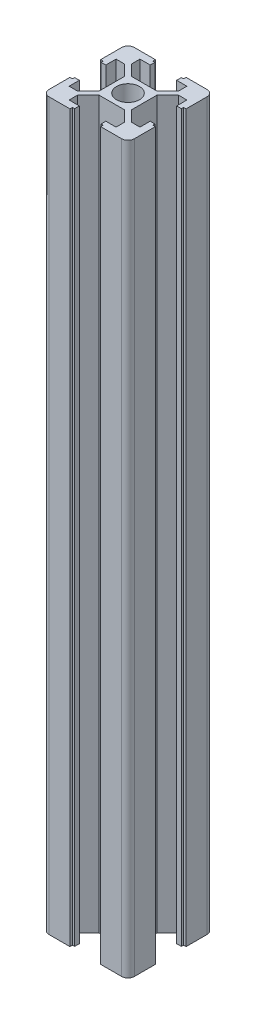
from build123d import *

# Parameters (mm, degrees)
SKETCH_1_W               = 20
SKETCH_1_H               = 20
EXTRUDE_1_DEPTH          = 85
SKETCH_4_R               = 2.7
CUT_EXTRUDE_3_DEPTH      = 9999
SKETCH_2_W               = 7.2
SKETCH_2_H               = 1.2
SKETCH_2_W_2             = 6.2
SKETCH_2_H_2             = 3.4
CUT_EXTRUDE_1_DEPTH      = 9999
CUT_EXTRUDE_2_DEPTH      = 9999
PATTERN_CIRCULAR_5_COUNT = 4
FILLET_1_R               = 1.5


with BuildPart() as part:
    # 草图1 → 凸台-拉伸1 (new, symmetric)
    with BuildSketch(Plane(origin=(0, 0, 0), x_dir=(1, 0, 0), z_dir=(0, 1, 0))):
        Rectangle(SKETCH_1_W, SKETCH_1_H)
    extrude(amount=EXTRUDE_1_DEPTH, both=True)

    # 草图4 → 切除-拉伸3 (cut)
    with BuildSketch(Plane(origin=(0, 85, 0), x_dir=(1, 0, 0), z_dir=(0, 1, 0))):
        with Locations(Location((0, 0, 0), (0, 0, 270))):
            Circle(SKETCH_4_R)
    extrude(amount=-CUT_EXTRUDE_3_DEPTH, mode=Mode.SUBTRACT)

    # 草图2 → 切除-拉伸1 (cut)
    with BuildSketch(Plane(origin=(0, 85, 0), x_dir=(1, 0, 0), z_dir=(0, 1, 0))):
        with Locations((0, 10)):
            Rectangle(SKETCH_2_W, SKETCH_2_H)
        with Locations((0, 10)):
            Rectangle(SKETCH_2_W_2, SKETCH_2_H_2)
    cut_extrude_1 = extrude(amount=-CUT_EXTRUDE_1_DEPTH, mode=Mode.SUBTRACT)

    # 草图3 → 切除-拉伸2 (cut)
    with BuildSketch(Plane(origin=(0, 85, 0), x_dir=(1, 0, 0), z_dir=(0, 1, 0))):
        Polygon((5.5, 8.3), (-5.5, 8.3), (-5.5, 6.3), (-3, 3.8), (3, 3.8), (5.5, 6.3), align=None)
    cut_extrude_2 = extrude(amount=-CUT_EXTRUDE_2_DEPTH, mode=Mode.SUBTRACT)

    # 阵列(圆周)5: 切除-拉伸1, 切除-拉伸2 ×4 about axis
    pattern_circular_5_axis = Axis((0, 0, 0), (0, 1, 0))
    add([cut_extrude_1.rotate(pattern_circular_5_axis, i * 360 / PATTERN_CIRCULAR_5_COUNT) for i in range(1, PATTERN_CIRCULAR_5_COUNT)], mode=Mode.SUBTRACT)
    add([cut_extrude_2.rotate(pattern_circular_5_axis, i * 360 / PATTERN_CIRCULAR_5_COUNT) for i in range(1, PATTERN_CIRCULAR_5_COUNT)], mode=Mode.SUBTRACT)

    # 圆角1
    fillet_1_edges = [part.edges().sort_by_distance(p)[0] for p in [
        (10, 0, 10),
        (-10, 0, 10),
        (-10, 0, -10),
        (10, 0, -10),
    ]]
    fillet(fillet_1_edges, radius=FILLET_1_R)


solid = part.part
